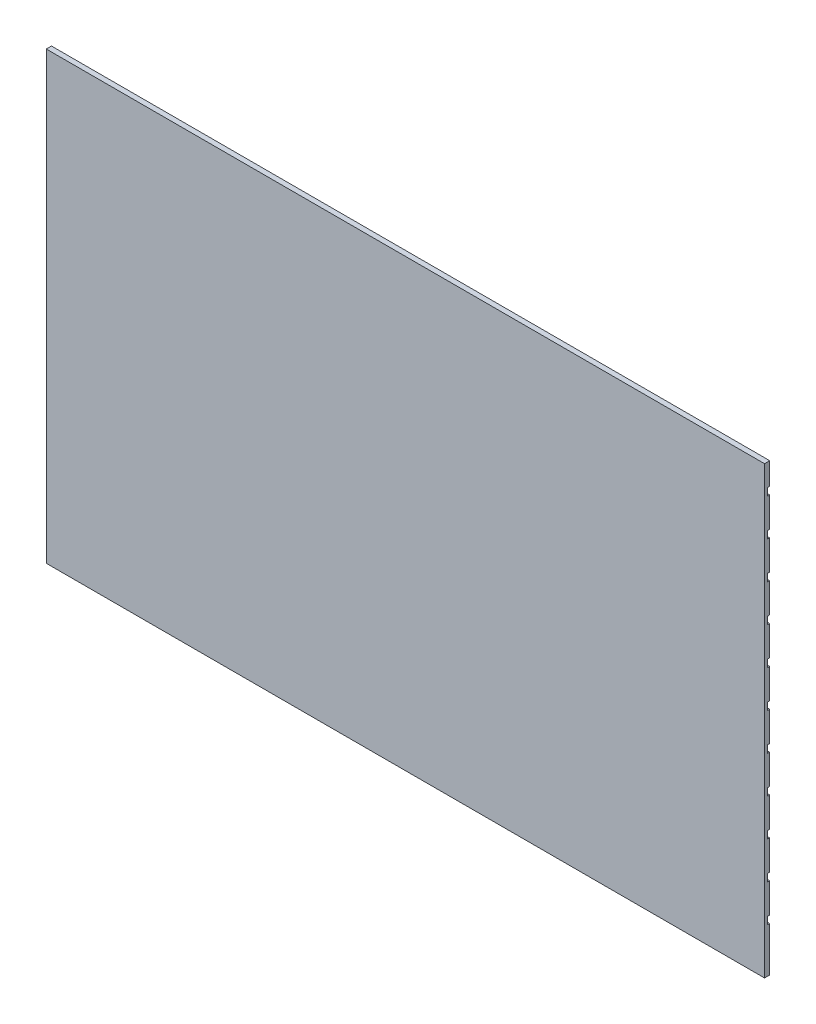
from build123d import *

# Parameters (mm, degrees)
SKETCH2_W           = 17.78
SKETCH2_H           = 1524
BOSS_EXTRUDE1_DEPTH = 2457.45
SKETCH3_W           = 2457.45
SKETCH3_H           = 25.4
CUT_EXTRUDE1_DEPTH  = 7.62


with BuildPart() as part:
    # Sketch2 → Boss-Extrude1 (new body)
    with BuildSketch(Plane(origin=(0, 0, 0), x_dir=(0, 0, -1), z_dir=(1, 0, 0))):
        with Locations((8.89, -762)):
            Rectangle(SKETCH2_W, SKETCH2_H)
    extrude(amount=BOSS_EXTRUDE1_DEPTH)

    # Sketch3 → Cut-Extrude1 (cut)
    with BuildSketch(Plane(origin=(0, 0, -17.78), x_dir=(-1, 0, 0), z_dir=(0, 0, -1))):
        with Locations((-1228.725, -88.9)):
            Rectangle(SKETCH3_W, SKETCH3_H)
        with Locations((-1228.725, -215.9)):
            Rectangle(SKETCH3_W, SKETCH3_H)
        with Locations((-1228.725, -342.9)):
            Rectangle(SKETCH3_W, SKETCH3_H)
        with Locations((-1228.725, -469.9)):
            Rectangle(SKETCH3_W, SKETCH3_H)
        with Locations((-1228.725, -596.9)):
            Rectangle(SKETCH3_W, SKETCH3_H)
        with Locations((-1228.725, -723.9)):
            Rectangle(SKETCH3_W, SKETCH3_H)
        with Locations((-1228.725, -850.9)):
            Rectangle(SKETCH3_W, SKETCH3_H)
        with Locations((-1228.725, -977.9)):
            Rectangle(SKETCH3_W, SKETCH3_H)
        with Locations((-1228.725, -1104.9)):
            Rectangle(SKETCH3_W, SKETCH3_H)
        with Locations((-1228.725, -1231.9)):
            Rectangle(SKETCH3_W, SKETCH3_H)
        with Locations((-1228.725, -1358.9)):
            Rectangle(SKETCH3_W, SKETCH3_H)
    extrude(amount=-CUT_EXTRUDE1_DEPTH, mode=Mode.SUBTRACT)


solid = part.part
